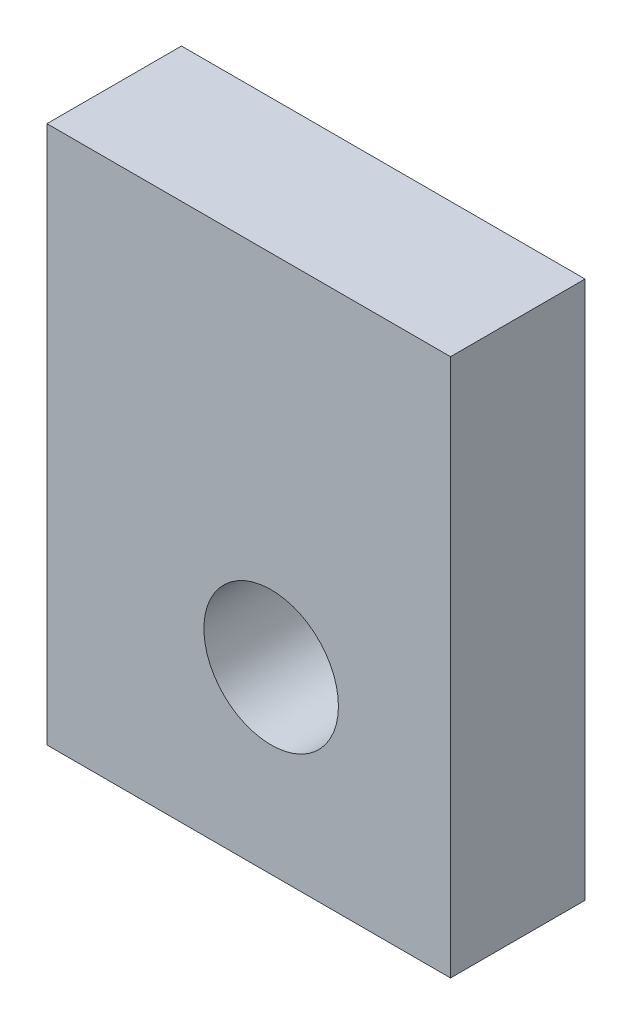
from build123d import *

# Parameters (mm, degrees)
SKETCH_1_W          = 9
SKETCH_1_H          = 12
EXTRUDE_1_DEPTH     = 3
SKETCH_2_R          = 1.5
CUT_EXTRUDE_1_DEPTH = 16.297058541


with BuildPart() as part:
    # Эскиз1 → Бобышка-Вытянуть1 (new body)
    with BuildSketch(Plane.XY):
        with Locations((4.5, 6)):
            Rectangle(SKETCH_1_W, SKETCH_1_H)
    extrude(amount=EXTRUDE_1_DEPTH)

    # Эскиз2 → Вырез-Вытянуть1 (cut, through all)
    with BuildSketch(Plane.XY.offset(3)):
        with Locations((5, 4)):
            Circle(SKETCH_2_R)
    extrude(amount=-CUT_EXTRUDE_1_DEPTH, mode=Mode.SUBTRACT)


solid = part.part
